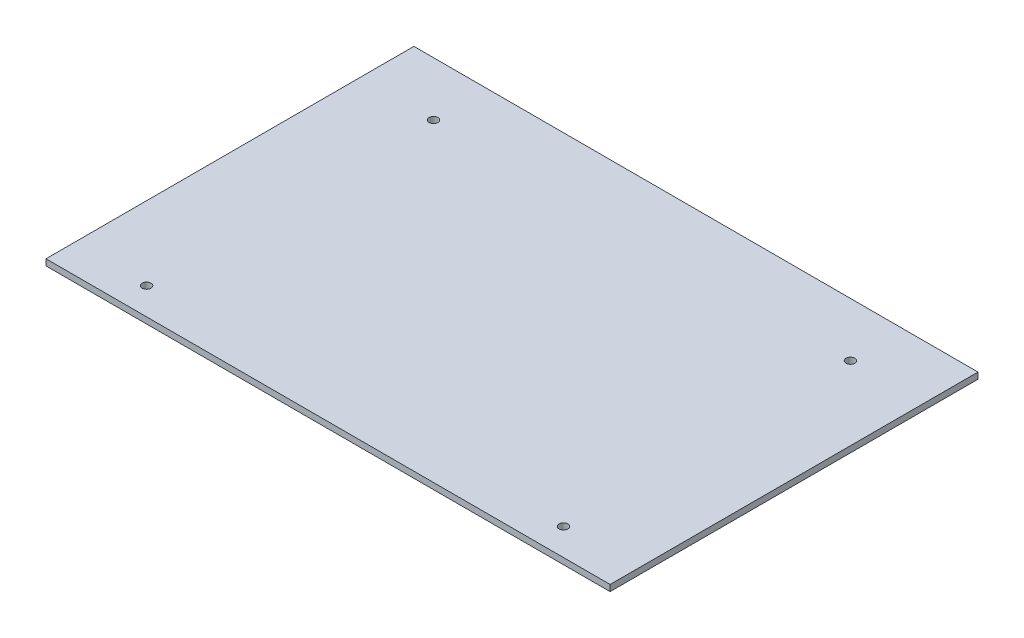
from build123d import *

# Parameters (mm, degrees)
CROQUIS2_W              = 1150
CROQUIS2_H              = 750
SALIENTE_EXTRUIR1_DEPTH = 12.7
CROQUIS7_R              = 9
CORTAR_EXTRUIR1_DEPTH   = 120


with BuildPart() as part:
    # Croquis2 → Saliente-Extruir1 (new body)
    with BuildSketch(Plane(origin=(0, 0, 0), x_dir=(1, 0, 0), z_dir=(0, 1, 0))):
        with Locations((575, -375)):
            Rectangle(CROQUIS2_W, CROQUIS2_H)
    extrude(amount=SALIENTE_EXTRUIR1_DEPTH)

    # Croquis7 → Cortar-Extruir1 (cut)
    with BuildSketch(Plane(origin=(0, 12.7, 0), x_dir=(1, 0, 0), z_dir=(0, 1, 0))):
        with Locations(Location((1000, -110, 0), (0, 0, 270))):
            Circle(CROQUIS7_R)
        with Locations(Location((150, -110, 0), (0, 0, 270))):
            Circle(CROQUIS7_R)
        with Locations(Location((1000, -695, 0), (0, 0, 270))):
            Circle(CROQUIS7_R)
        with Locations(Location((150, -695, 0), (0, 0, 270))):
            Circle(CROQUIS7_R)
    extrude(amount=-CORTAR_EXTRUIR1_DEPTH, mode=Mode.SUBTRACT)


solid = part.part
